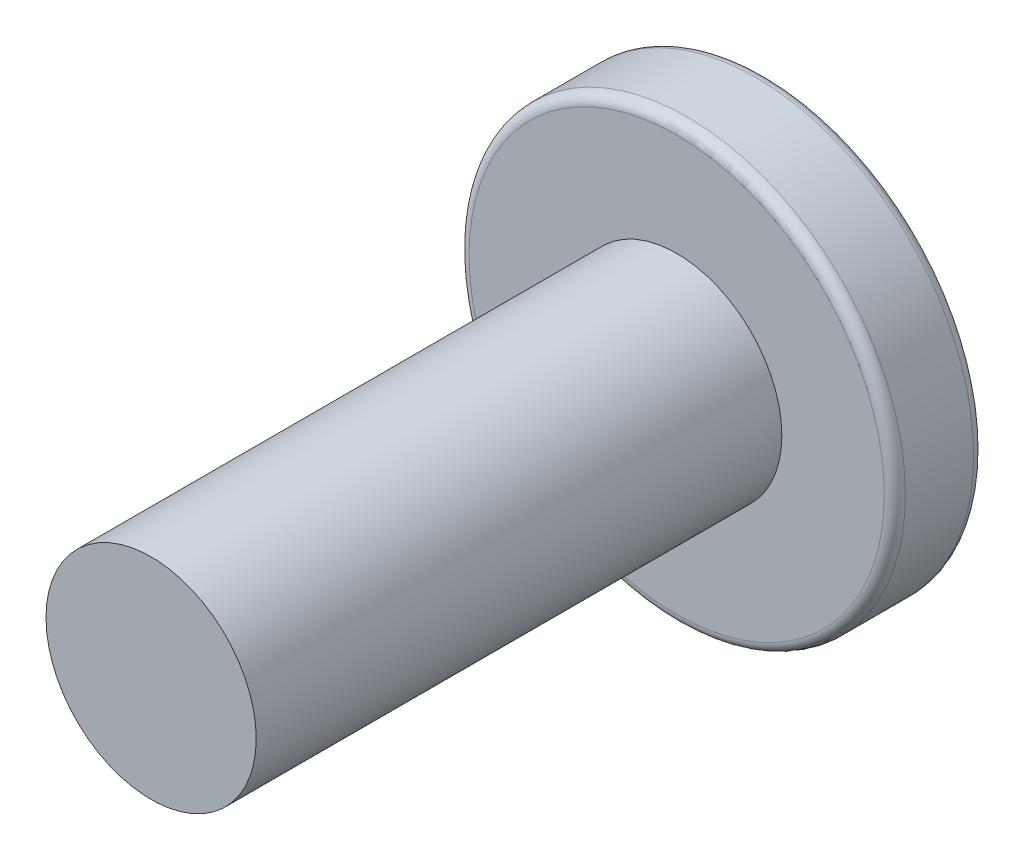
from build123d import *

# Parameters (mm, degrees)
SKETCH_1_R          = 4.15
EXTRUDE_1_DEPTH     = 1.7
SKETCH_2_R          = 2
EXTRUDE_2_DEPTH     = 10
FILLET_1_R          = 0.2
CUT_EXTRUDE_1_DEPTH = 1.5


with BuildPart() as part:
    # 草图1 → 凸台-拉伸1 (new body)
    with BuildSketch(Plane.XY):
        Circle(SKETCH_1_R)
    extrude(amount=EXTRUDE_1_DEPTH)

    # 草图2 → 凸台-拉伸2 (add)
    with BuildSketch(Plane.XY.offset(1.7)):
        Circle(SKETCH_2_R)
    extrude(amount=EXTRUDE_2_DEPTH)

    # 圆角1
    fillet_1_edges = [part.edges().sort_by_distance(p)[0] for p in [
        (-4.15, 0, 0),
        (-4.15, 0, 1.7),
    ]]
    fillet(fillet_1_edges, radius=FILLET_1_R)

    # 草图3 → 切除-拉伸1 (cut)
    with BuildSketch(Plane(origin=(0, 0, 0), x_dir=(-1, 0, 0), z_dir=(0, 0, -1))):
        Polygon((1.154700538, 0), (0.577350269, 1), (-0.577350269, 1), (-1.154700538, 0), (-0.577350269, -1), (0.577350269, -1), align=None)
    extrude(amount=-CUT_EXTRUDE_1_DEPTH, mode=Mode.SUBTRACT)


solid = part.part
